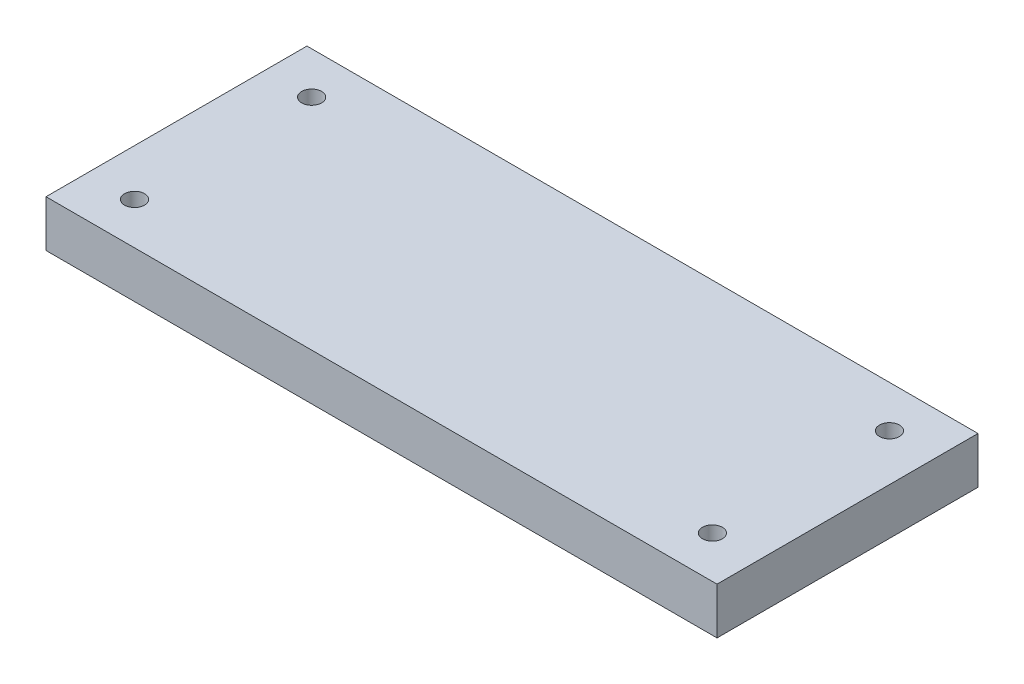
from build123d import *

# Parameters (mm, degrees)
SKETCH1_W                  = 228.6
SKETCH1_H                  = 88.9
BOSS_EXTRUDE1_DEPTH        = 15.875
M8X1_25_TAPPED_HOLE1_D     = 6.8
M8X1_25_TAPPED_HOLE1_DEPTH = 19.7612
M8X1_25_TAPPED_HOLE1_TIP   = 2.042926105


with BuildPart() as part:
    # Sketch1 → Boss-Extrude1 (new body)
    with BuildSketch(Plane(origin=(0, 0, 0), x_dir=(1, 0, 0), z_dir=(0, 1, 0))):
        Rectangle(SKETCH1_W, SKETCH1_H)
    extrude(amount=BOSS_EXTRUDE1_DEPTH)

    # M8x1.25 Tapped Hole1
    with Locations(Plane(origin=(0, 15.875, 0), x_dir=(1, 0, 0), z_dir=(0, 1, 0))):
        with Locations((-98.425, -30.1625), (-98.425, 30.1625), (98.425, 30.1625), (98.425, -30.1625)):
            Hole(M8X1_25_TAPPED_HOLE1_D / 2, depth=M8X1_25_TAPPED_HOLE1_DEPTH)
            with Locations((0, 0, -(M8X1_25_TAPPED_HOLE1_DEPTH + M8X1_25_TAPPED_HOLE1_TIP / 2))):  # 118° drill point
                Cone(0, M8X1_25_TAPPED_HOLE1_D / 2, M8X1_25_TAPPED_HOLE1_TIP, mode=Mode.SUBTRACT)


solid = part.part
